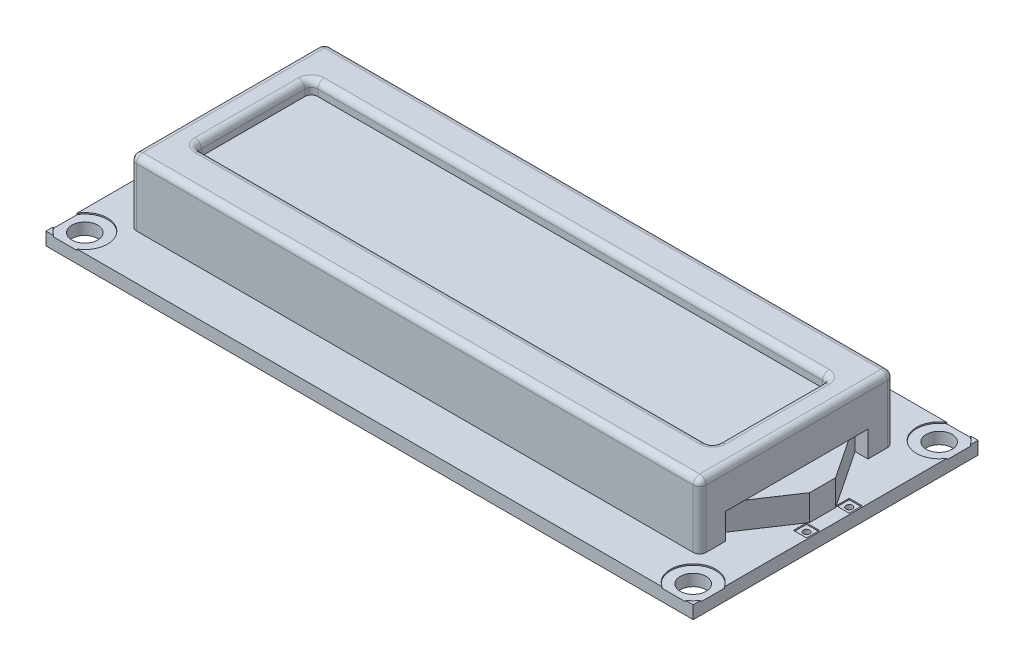
from build123d import *

# Parameters (mm, degrees)
SKETCH1_W           = 79.375
SKETCH1_H           = 34.925
SKETCH1_W_2         = 69.85
SKETCH1_H_2         = 23.8125
BOSS_EXTRUDE1_DEPTH = 1.5875
SKETCH1_3_W         = 69.85
SKETCH1_3_H         = 23.8125
BOSS_EXTRUDE2_DEPTH = 9.525
SKETCH2_R           = 1.5875
CUT_EXTRUDE1_DEPTH  = 45.079932722
SKETCH3_W           = 63.5
SKETCH3_H           = 14.2875
CUT_EXTRUDE2_DEPTH  = 1.5875
FILLET1_R           = 0.79375
SKETCH4_R           = 2.778125
CUT_EXTRUDE4_DEPTH  = 0.15875
SKETCH5_W           = 3.175
SKETCH5_H           = 17.4625
CUT_EXTRUDE5_DEPTH  = 1.5875
SKETCH7_W           = 1.5875
SKETCH7_H           = 1.5875
CUT_EXTRUDE6_DEPTH  = 0.15875
SKETCH8_R           = 0.396875
CUT_EXTRUDE7_DEPTH  = 1.5875
SKETCH9_W           = 1.5875
SKETCH9_H           = 3.175
BOSS_EXTRUDE4_DEPTH = 0.79375
FILLET2_R           = 0.5953125
BOSS_EXTRUDE5_DEPTH = 2.38125
SKETCH11_W          = 0.79375
SKETCH11_H          = 0.817184428
BOSS_EXTRUDE6_DEPTH = 6.35


with BuildPart() as part:
    # Sketch1 → Boss-Extrude1 (new body)
    # profile 1 of 2: a face of its own
    with BuildSketch(Plane(origin=(0, 0, 0), x_dir=(1, 0, 0), z_dir=(0, 1, 0))):
        Rectangle(SKETCH1_W, SKETCH1_H)
        Rectangle(SKETCH1_W_2, SKETCH1_H_2, mode=Mode.SUBTRACT)
    # profile 2 of 2: a face of its own
    with BuildSketch(Plane(origin=(0, 0, 0), x_dir=(1, 0, 0), z_dir=(0, 1, 0))):
        Rectangle(SKETCH1_W_2, SKETCH1_H_2)
    extrude(amount=BOSS_EXTRUDE1_DEPTH)

    # Sketch1<3> → Boss-Extrude2 (add)
    with BuildSketch(Plane(origin=(0, 0, 0), x_dir=(1, 0, 0), z_dir=(0, 1, 0))):
        Rectangle(SKETCH1_3_W, SKETCH1_3_H)
    extrude(amount=BOSS_EXTRUDE2_DEPTH)

    # Sketch2 → Cut-Extrude1 (cut, through all)
    with BuildSketch(Plane(origin=(0, 1.5875, 0), x_dir=(1, 0, 0), z_dir=(0, 1, 0))):
        with Locations(Location((-37.30625, 15.08125, 0), (0, 0, 270))):
            Circle(SKETCH2_R)
        with Locations(Location((-37.30625, -15.08125, 0), (0, 0, 270))):
            Circle(SKETCH2_R)
        with Locations(Location((37.30625, -15.08125, 0), (0, 0, 270))):
            Circle(SKETCH2_R)
        with Locations(Location((37.30625, 15.08125, 0), (0, 0, 270))):
            Circle(SKETCH2_R)
    extrude(amount=-CUT_EXTRUDE1_DEPTH, mode=Mode.SUBTRACT)

    # Sketch3 → Cut-Extrude2 (cut)
    with BuildSketch(Plane(origin=(0, 9.525, 0), x_dir=(1, 0, 0), z_dir=(0, 1, 0))):
        Rectangle(SKETCH3_W, SKETCH3_H)
    extrude(amount=-CUT_EXTRUDE2_DEPTH, mode=Mode.SUBTRACT)

    # Fillet1
    fillet1_edges = [part.edges().sort_by_distance(p)[0] for p in [
        (-34.925, 5.55625, 11.90625),
        (34.925, 5.55625, 11.90625),
        (34.925, 5.55625, -11.90625),
        (0, 9.525, -11.90625),
        (-34.925, 5.55625, -11.90625),
        (-34.925, 9.525, 0),
        (0, 9.525, 11.90625),
        (34.925, 9.525, 0),
        (-31.75, 8.73125, 7.14375),
        (-31.75, 8.73125, -7.14375),
        (31.75, 8.73125, -7.14375),
        (31.75, 8.73125, 7.14375),
        (-31.75, 9.525, 0),
        (0, 9.525, 7.14375),
        (31.75, 9.525, 0),
        (0, 9.525, -7.14375),
    ]]
    fillet(fillet1_edges, radius=FILLET1_R)

    # Sketch4 → Cut-Extrude4 (cut)
    with BuildSketch(Plane(origin=(0, 1.5875, 0), x_dir=(1, 0, 0), z_dir=(0, 1, 0))):
        with Locations((-37.30625, 15.08125)):
            Circle(SKETCH4_R)
        with Locations((-37.30625, -15.08125)):
            Circle(SKETCH4_R)
        with Locations((37.30625, -15.08125)):
            Circle(SKETCH4_R)
        with Locations((37.30625, 15.08125)):
            Circle(SKETCH4_R)
    extrude(amount=-CUT_EXTRUDE4_DEPTH, mode=Mode.SUBTRACT)

    # Sketch5 → Cut-Extrude5 (cut)
    with BuildSketch(Plane(origin=(34.925, 36.5125, 0), x_dir=(0, -1, 0), z_dir=(1, 0, 0))):
        with Locations((33.3375, 0)):
            Rectangle(SKETCH5_W, SKETCH5_H)
    extrude(amount=-CUT_EXTRUDE5_DEPTH, mode=Mode.SUBTRACT)

    # Sketch6 → section 0 of loft1
    with BuildSketch(Plane(origin=(38.1, 0, 0), x_dir=(0, 0, -1), z_dir=(1, 0, 0)), mode=Mode.PRIVATE) as loft1_s0:
        with BuildLine():
            Line((-1.5875, 1.5875), (1.5875, 1.5875))
            Line((1.5875, 1.5875), (1.5875, 4.7625))
            Line((1.5875, 4.7625), (-1.5875, 4.7625))
            Line((-1.5875, 4.7625), (-1.5875, 1.5875))
        make_face()
    # loft up to a face of the part (loft1)
    loft([loft1_s0.sketch, part.faces().sort_by_distance((33.3375, 3.175, 0))[0]])

    # Sketch7 → Cut-Extrude6 (cut)
    with BuildSketch(Plane(origin=(0, 1.5875, 0), x_dir=(1, 0, 0), z_dir=(0, 1, 0))):
        with Locations((38.735, 2.619375)):
            Rectangle(SKETCH7_W, SKETCH7_H)
        with Locations((38.735, -2.619375)):
            Rectangle(SKETCH7_W, SKETCH7_H)
    extrude(amount=-CUT_EXTRUDE6_DEPTH, mode=Mode.SUBTRACT)

    # Sketch8 → Cut-Extrude7 (cut)
    with BuildSketch(Plane(origin=(0, 1.42875, 0), x_dir=(1, 0, 0), z_dir=(0, 1, 0))):
        with Locations(Location((38.735, 2.619375, 0), (0, 0, 270))):
            Circle(SKETCH8_R)
        with Locations(Location((38.735, -2.619375, 0), (0, 0, 270))):
            Circle(SKETCH8_R)
    extrude(amount=-CUT_EXTRUDE7_DEPTH, mode=Mode.SUBTRACT)

    # Sketch9 → Boss-Extrude4 (add)
    with BuildSketch(Plane(origin=(0, 1.5875, 0), x_dir=(1, 0, 0), z_dir=(0, 1, 0))):
        with Locations((-32.54375, 15.71625)):
            Rectangle(SKETCH9_W, SKETCH9_H)
        with Locations((-30.16123, 15.71625)):
            Rectangle(SKETCH9_W, SKETCH9_H)
        with Locations((-27.77871, 15.71625)):
            Rectangle(SKETCH9_W, SKETCH9_H)
        with Locations((-25.39619, 15.71625)):
            Rectangle(SKETCH9_W, SKETCH9_H)
        with Locations((-23.01367, 15.71625)):
            Rectangle(SKETCH9_W, SKETCH9_H)
        with Locations((-20.63115, 15.71625)):
            Rectangle(SKETCH9_W, SKETCH9_H)
        with Locations((-18.24863, 15.71625)):
            Rectangle(SKETCH9_W, SKETCH9_H)
        with Locations((-15.86611, 15.71625)):
            Rectangle(SKETCH9_W, SKETCH9_H)
        with Locations((-13.48359, 15.71625)):
            Rectangle(SKETCH9_W, SKETCH9_H)
        with Locations((-11.10107, 15.71625)):
            Rectangle(SKETCH9_W, SKETCH9_H)
        with Locations((-8.71855, 15.71625)):
            Rectangle(SKETCH9_W, SKETCH9_H)
        with Locations((-6.33603, 15.71625)):
            Rectangle(SKETCH9_W, SKETCH9_H)
        with Locations((-3.95351, 15.71625)):
            Rectangle(SKETCH9_W, SKETCH9_H)
        with Locations((-1.57099, 15.71625)):
            Rectangle(SKETCH9_W, SKETCH9_H)
        with Locations((0.81153, 15.71625)):
            Rectangle(SKETCH9_W, SKETCH9_H)
        with Locations((3.19405, 15.71625)):
            Rectangle(SKETCH9_W, SKETCH9_H)
    extrude(amount=BOSS_EXTRUDE4_DEPTH)

    # Fillet2
    fillet2_edges = [part.edges().sort_by_distance(p)[0] for p in [
        (-33.3375, 2.38125, -15.71625),
        (-32.54375, 2.38125, -14.12875),
        (-31.75, 2.38125, -15.71625),
        (-32.54375, 2.38125, -17.30375),
        (-30.16123, 2.38125, -17.30375),
        (-30.95498, 2.38125, -15.71625),
        (-30.16123, 2.38125, -14.12875),
        (-29.36748, 2.38125, -15.71625),
        (-27.77871, 2.38125, -17.30375),
        (-28.57246, 2.38125, -15.71625),
        (-27.77871, 2.38125, -14.12875),
        (-26.98496, 2.38125, -15.71625),
        (-25.39619, 2.38125, -17.30375),
        (-26.18994, 2.38125, -15.71625),
        (-25.39619, 2.38125, -14.12875),
        (-24.60244, 2.38125, -15.71625),
        (-23.01367, 2.38125, -17.30375),
        (-23.80742, 2.38125, -15.71625),
        (-23.01367, 2.38125, -14.12875),
        (-22.21992, 2.38125, -15.71625),
        (-20.63115, 2.38125, -17.30375),
        (-21.4249, 2.38125, -15.71625),
        (-20.63115, 2.38125, -14.12875),
        (-19.8374, 2.38125, -15.71625),
        (-18.24863, 2.38125, -17.30375),
        (-19.04238, 2.38125, -15.71625),
        (-18.24863, 2.38125, -14.12875),
        (-17.45488, 2.38125, -15.71625),
        (-15.86611, 2.38125, -17.30375),
        (-16.65986, 2.38125, -15.71625),
        (-15.86611, 2.38125, -14.12875),
        (-15.07236, 2.38125, -15.71625),
        (-13.48359, 2.38125, -17.30375),
        (-14.27734, 2.38125, -15.71625),
        (-13.48359, 2.38125, -14.12875),
        (-12.68984, 2.38125, -15.71625),
        (-11.10107, 2.38125, -17.30375),
        (-11.89482, 2.38125, -15.71625),
        (-11.10107, 2.38125, -14.12875),
        (-10.30732, 2.38125, -15.71625),
        (-8.71855, 2.38125, -17.30375),
        (-9.5123, 2.38125, -15.71625),
        (-8.71855, 2.38125, -14.12875),
        (-7.9248, 2.38125, -15.71625),
        (-6.33603, 2.38125, -17.30375),
        (-7.12978, 2.38125, -15.71625),
        (-6.33603, 2.38125, -14.12875),
        (-5.54228, 2.38125, -15.71625),
        (-3.95351, 2.38125, -17.30375),
        (-4.74726, 2.38125, -15.71625),
        (-3.95351, 2.38125, -14.12875),
        (-3.15976, 2.38125, -15.71625),
        (-1.57099, 2.38125, -17.30375),
        (-2.36474, 2.38125, -15.71625),
        (-1.57099, 2.38125, -14.12875),
        (-0.77724, 2.38125, -15.71625),
        (0.81153, 2.38125, -17.30375),
        (0.01778, 2.38125, -15.71625),
        (0.81153, 2.38125, -14.12875),
        (1.60528, 2.38125, -15.71625),
        (3.19405, 2.38125, -17.30375),
        (2.4003, 2.38125, -15.71625),
        (3.19405, 2.38125, -14.12875),
        (3.9878, 2.38125, -15.71625),
    ]]
    fillet(fillet2_edges, radius=FILLET2_R)

    # Sketch10 → Boss-Extrude5 (add)
    with BuildSketch(Plane.XZ):
        with BuildLine():
            Line((-33.02, -17.30375), (-31.27375, -17.30375))
            ThreePointArc((-31.27375, -17.30375), (-31.049243597, -17.210756403), (-30.95625, -16.98625))
            Line((-30.95625, -16.98625), (-30.95625, -15.24))
            ThreePointArc((-30.95625, -15.24), (-31.049243597, -15.015493597), (-31.27375, -14.9225))
            Line((-31.27375, -14.9225), (-33.02, -14.9225))
            ThreePointArc((-33.02, -14.9225), (-33.244506403, -15.015493597), (-33.3375, -15.24))
            Line((-33.3375, -15.24), (-33.3375, -16.98625))
            ThreePointArc((-33.3375, -16.98625), (-33.244506403, -17.210756403), (-33.02, -17.30375))
        make_face()
        with BuildLine():
            Line((-30.63748, -14.9225), (-28.89123, -14.9225))
            ThreePointArc((-28.89123, -14.9225), (-28.666723597, -15.015493597), (-28.57373, -15.24))
            Line((-28.57373, -15.24), (-28.57373, -16.98625))
            ThreePointArc((-28.57373, -16.98625), (-28.666723597, -17.210756403), (-28.89123, -17.30375))
            Line((-28.89123, -17.30375), (-30.63748, -17.30375))
            ThreePointArc((-30.63748, -17.30375), (-30.861986403, -17.210756403), (-30.95498, -16.98625))
            Line((-30.95498, -16.98625), (-30.95498, -15.24))
            ThreePointArc((-30.95498, -15.24), (-30.861986403, -15.015493597), (-30.63748, -14.9225))
        make_face()
        with BuildLine():
            Line((-28.25496, -14.9225), (-26.50871, -14.9225))
            ThreePointArc((-26.50871, -14.9225), (-26.284203597, -15.015493597), (-26.19121, -15.24))
            Line((-26.19121, -15.24), (-26.19121, -16.98625))
            ThreePointArc((-26.19121, -16.98625), (-26.284203597, -17.210756403), (-26.50871, -17.30375))
            Line((-26.50871, -17.30375), (-28.25496, -17.30375))
            ThreePointArc((-28.25496, -17.30375), (-28.479466403, -17.210756403), (-28.57246, -16.98625))
            Line((-28.57246, -16.98625), (-28.57246, -15.24))
            ThreePointArc((-28.57246, -15.24), (-28.479466403, -15.015493597), (-28.25496, -14.9225))
        make_face()
        with BuildLine():
            Line((-25.87244, -14.9225), (-24.12619, -14.9225))
            ThreePointArc((-24.12619, -14.9225), (-23.901683597, -15.015493597), (-23.80869, -15.24))
            Line((-23.80869, -15.24), (-23.80869, -16.98625))
            ThreePointArc((-23.80869, -16.98625), (-23.901683597, -17.210756403), (-24.12619, -17.30375))
            Line((-24.12619, -17.30375), (-25.87244, -17.30375))
            ThreePointArc((-25.87244, -17.30375), (-26.096946403, -17.210756403), (-26.18994, -16.98625))
            Line((-26.18994, -16.98625), (-26.18994, -15.24))
            ThreePointArc((-26.18994, -15.24), (-26.096946403, -15.015493597), (-25.87244, -14.9225))
        make_face()
        with BuildLine():
            Line((-23.48992, -14.9225), (-21.74367, -14.9225))
            ThreePointArc((-21.74367, -14.9225), (-21.519163597, -15.015493597), (-21.42617, -15.24))
            Line((-21.42617, -15.24), (-21.42617, -16.98625))
            ThreePointArc((-21.42617, -16.98625), (-21.519163597, -17.210756403), (-21.74367, -17.30375))
            Line((-21.74367, -17.30375), (-23.48992, -17.30375))
            ThreePointArc((-23.48992, -17.30375), (-23.714426403, -17.210756403), (-23.80742, -16.98625))
            Line((-23.80742, -16.98625), (-23.80742, -15.24))
            ThreePointArc((-23.80742, -15.24), (-23.714426403, -15.015493597), (-23.48992, -14.9225))
        make_face()
        with BuildLine():
            Line((-21.1074, -14.9225), (-19.36115, -14.9225))
            ThreePointArc((-19.36115, -14.9225), (-19.136643597, -15.015493597), (-19.04365, -15.24))
            Line((-19.04365, -15.24), (-19.04365, -16.98625))
            ThreePointArc((-19.04365, -16.98625), (-19.136643597, -17.210756403), (-19.36115, -17.30375))
            Line((-19.36115, -17.30375), (-21.1074, -17.30375))
            ThreePointArc((-21.1074, -17.30375), (-21.331906403, -17.210756403), (-21.4249, -16.98625))
            Line((-21.4249, -16.98625), (-21.4249, -15.24))
            ThreePointArc((-21.4249, -15.24), (-21.331906403, -15.015493597), (-21.1074, -14.9225))
        make_face()
        with BuildLine():
            Line((-18.72488, -14.9225), (-16.97863, -14.9225))
            ThreePointArc((-16.97863, -14.9225), (-16.754123597, -15.015493597), (-16.66113, -15.24))
            Line((-16.66113, -15.24), (-16.66113, -16.98625))
            ThreePointArc((-16.66113, -16.98625), (-16.754123597, -17.210756403), (-16.97863, -17.30375))
            Line((-16.97863, -17.30375), (-18.72488, -17.30375))
            ThreePointArc((-18.72488, -17.30375), (-18.949386403, -17.210756403), (-19.04238, -16.98625))
            Line((-19.04238, -16.98625), (-19.04238, -15.24))
            ThreePointArc((-19.04238, -15.24), (-18.949386403, -15.015493597), (-18.72488, -14.9225))
        make_face()
        with BuildLine():
            Line((-16.34236, -14.9225), (-14.59611, -14.9225))
            ThreePointArc((-14.59611, -14.9225), (-14.371603597, -15.015493597), (-14.27861, -15.24))
            Line((-14.27861, -15.24), (-14.27861, -16.98625))
            ThreePointArc((-14.27861, -16.98625), (-14.371603597, -17.210756403), (-14.59611, -17.30375))
            Line((-14.59611, -17.30375), (-16.34236, -17.30375))
            ThreePointArc((-16.34236, -17.30375), (-16.566866403, -17.210756403), (-16.65986, -16.98625))
            Line((-16.65986, -16.98625), (-16.65986, -15.24))
            ThreePointArc((-16.65986, -15.24), (-16.566866403, -15.015493597), (-16.34236, -14.9225))
        make_face()
        with BuildLine():
            Line((-13.95984, -14.9225), (-12.21359, -14.9225))
            ThreePointArc((-12.21359, -14.9225), (-11.989083597, -15.015493597), (-11.89609, -15.24))
            Line((-11.89609, -15.24), (-11.89609, -16.98625))
            ThreePointArc((-11.89609, -16.98625), (-11.989083597, -17.210756403), (-12.21359, -17.30375))
            Line((-12.21359, -17.30375), (-13.95984, -17.30375))
            ThreePointArc((-13.95984, -17.30375), (-14.184346403, -17.210756403), (-14.27734, -16.98625))
            Line((-14.27734, -16.98625), (-14.27734, -15.24))
            ThreePointArc((-14.27734, -15.24), (-14.184346403, -15.015493597), (-13.95984, -14.9225))
        make_face()
        with BuildLine():
            Line((-11.57732, -14.9225), (-9.83107, -14.9225))
            ThreePointArc((-9.83107, -14.9225), (-9.606563597, -15.015493597), (-9.51357, -15.24))
            Line((-9.51357, -15.24), (-9.51357, -16.98625))
            ThreePointArc((-9.51357, -16.98625), (-9.606563597, -17.210756403), (-9.83107, -17.30375))
            Line((-9.83107, -17.30375), (-11.57732, -17.30375))
            ThreePointArc((-11.57732, -17.30375), (-11.801826403, -17.210756403), (-11.89482, -16.98625))
            Line((-11.89482, -16.98625), (-11.89482, -15.24))
            ThreePointArc((-11.89482, -15.24), (-11.801826403, -15.015493597), (-11.57732, -14.9225))
        make_face()
        with BuildLine():
            Line((-9.1948, -14.9225), (-7.44855, -14.9225))
            ThreePointArc((-7.44855, -14.9225), (-7.224043597, -15.015493597), (-7.13105, -15.24))
            Line((-7.13105, -15.24), (-7.13105, -16.98625))
            ThreePointArc((-7.13105, -16.98625), (-7.224043597, -17.210756403), (-7.44855, -17.30375))
            Line((-7.44855, -17.30375), (-9.1948, -17.30375))
            ThreePointArc((-9.1948, -17.30375), (-9.419306403, -17.210756403), (-9.5123, -16.98625))
            Line((-9.5123, -16.98625), (-9.5123, -15.24))
            ThreePointArc((-9.5123, -15.24), (-9.419306403, -15.015493597), (-9.1948, -14.9225))
        make_face()
        with BuildLine():
            Line((-6.81228, -14.9225), (-5.06603, -14.9225))
            ThreePointArc((-5.06603, -14.9225), (-4.841523597, -15.015493597), (-4.74853, -15.24))
            Line((-4.74853, -15.24), (-4.74853, -16.98625))
            ThreePointArc((-4.74853, -16.98625), (-4.841523597, -17.210756403), (-5.06603, -17.30375))
            Line((-5.06603, -17.30375), (-6.81228, -17.30375))
            ThreePointArc((-6.81228, -17.30375), (-7.036786403, -17.210756403), (-7.12978, -16.98625))
            Line((-7.12978, -16.98625), (-7.12978, -15.24))
            ThreePointArc((-7.12978, -15.24), (-7.036786403, -15.015493597), (-6.81228, -14.9225))
        make_face()
        with BuildLine():
            Line((-4.42976, -14.9225), (-2.68351, -14.9225))
            ThreePointArc((-2.68351, -14.9225), (-2.459003597, -15.015493597), (-2.36601, -15.24))
            Line((-2.36601, -15.24), (-2.36601, -16.98625))
            ThreePointArc((-2.36601, -16.98625), (-2.459003597, -17.210756403), (-2.68351, -17.30375))
            Line((-2.68351, -17.30375), (-4.42976, -17.30375))
            ThreePointArc((-4.42976, -17.30375), (-4.654266403, -17.210756403), (-4.74726, -16.98625))
            Line((-4.74726, -16.98625), (-4.74726, -15.24))
            ThreePointArc((-4.74726, -15.24), (-4.654266403, -15.015493597), (-4.42976, -14.9225))
        make_face()
        with BuildLine():
            Line((-2.04724, -14.9225), (-0.30099, -14.9225))
            ThreePointArc((-0.30099, -14.9225), (-0.076483597, -15.015493597), (0.01651, -15.24))
            Line((0.01651, -15.24), (0.01651, -16.98625))
            ThreePointArc((0.01651, -16.98625), (-0.076483597, -17.210756403), (-0.30099, -17.30375))
            Line((-0.30099, -17.30375), (-2.04724, -17.30375))
            ThreePointArc((-2.04724, -17.30375), (-2.271746403, -17.210756403), (-2.36474, -16.98625))
            Line((-2.36474, -16.98625), (-2.36474, -15.24))
            ThreePointArc((-2.36474, -15.24), (-2.271746403, -15.015493597), (-2.04724, -14.9225))
        make_face()
        with BuildLine():
            Line((0.33528, -14.9225), (2.08153, -14.9225))
            ThreePointArc((2.08153, -14.9225), (2.306036403, -15.015493597), (2.39903, -15.24))
            Line((2.39903, -15.24), (2.39903, -16.98625))
            ThreePointArc((2.39903, -16.98625), (2.306036403, -17.210756403), (2.08153, -17.30375))
            Line((2.08153, -17.30375), (0.33528, -17.30375))
            ThreePointArc((0.33528, -17.30375), (0.110773597, -17.210756403), (0.01778, -16.98625))
            Line((0.01778, -16.98625), (0.01778, -15.24))
            ThreePointArc((0.01778, -15.24), (0.110773597, -15.015493597), (0.33528, -14.9225))
        make_face()
        with BuildLine():
            Line((2.7178, -14.9225), (4.46405, -14.9225))
            ThreePointArc((4.46405, -14.9225), (4.688556403, -15.015493597), (4.78155, -15.24))
            Line((4.78155, -15.24), (4.78155, -16.98625))
            ThreePointArc((4.78155, -16.98625), (4.688556403, -17.210756403), (4.46405, -17.30375))
            Line((4.46405, -17.30375), (2.7178, -17.30375))
            ThreePointArc((2.7178, -17.30375), (2.493293597, -17.210756403), (2.4003, -16.98625))
            Line((2.4003, -16.98625), (2.4003, -15.24))
            ThreePointArc((2.4003, -15.24), (2.493293597, -15.015493597), (2.7178, -14.9225))
        make_face()
    extrude(amount=BOSS_EXTRUDE5_DEPTH)

    # Sketch11 → Boss-Extrude6 (add)
    with BuildSketch(Plane.XZ.offset(2.38125)):
        with Locations((1.208405, -16.113125)):
            Rectangle(SKETCH11_W, SKETCH11_H)
        with Locations((3.590925, -16.113125)):
            Rectangle(SKETCH11_W, SKETCH11_H)
        with Locations((-1.174115, -16.113125)):
            Rectangle(SKETCH11_W, SKETCH11_H)
        with Locations((-3.556635, -16.113125)):
            Rectangle(SKETCH11_W, SKETCH11_H)
        with Locations((-5.939155, -16.113125)):
            Rectangle(SKETCH11_W, SKETCH11_H)
        with Locations((-8.321675, -16.113125)):
            Rectangle(SKETCH11_W, SKETCH11_H)
        with Locations((-10.704195, -16.113125)):
            Rectangle(SKETCH11_W, SKETCH11_H)
        with Locations((-13.086715, -16.113125)):
            Rectangle(SKETCH11_W, SKETCH11_H)
        with Locations((-15.469235, -16.113125)):
            Rectangle(SKETCH11_W, SKETCH11_H)
        with Locations((-17.851755, -16.113125)):
            Rectangle(SKETCH11_W, SKETCH11_H)
        with Locations((-20.234275, -16.113125)):
            Rectangle(SKETCH11_W, SKETCH11_H)
        with Locations((-22.616795, -16.113125)):
            Rectangle(SKETCH11_W, SKETCH11_H)
        with Locations((-24.999315, -16.113125)):
            Rectangle(SKETCH11_W, SKETCH11_H)
        with Locations((-27.381835, -16.113125)):
            Rectangle(SKETCH11_W, SKETCH11_H)
        with Locations((-29.764355, -16.113125)):
            Rectangle(SKETCH11_W, SKETCH11_H)
        with Locations((-32.146875, -16.113125)):
            Rectangle(SKETCH11_W, SKETCH11_H)
    extrude(amount=BOSS_EXTRUDE6_DEPTH)


solid = part.part
